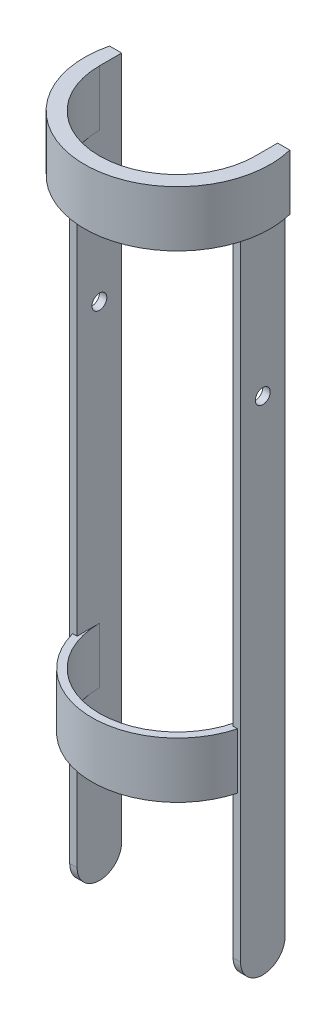
from build123d import *

# Parameters (mm, degrees)
EXTRUDE_1_DEPTH     = 30
SKETCH_2_W          = 4
SKETCH_2_H          = 24
EXTRUDE_2_DEPTH     = 120
CUT_EXTRUDE_1_DEPTH = 137.674796506
SKETCH_4_W          = 4
SKETCH_4_H          = 24
EXTRUDE_3_DEPTH     = 260
EXTRUDE_START       = -30
EXTRUDE_4_DEPTH     = 30
SKETCH_6_R          = 4
CUT_EXTRUDE_2_DEPTH = 310.541596559


with BuildPart() as part:
    # 草图1 → 凸台-拉伸1 (new body)
    with BuildSketch(Plane(origin=(0, 0, 0), x_dir=(1, 0, 0), z_dir=(0, 1, 0))):
        with BuildLine():
            Line((-46, 0), (-46, 12))
            Line((-46, 12), (-42, 12))
            Line((-42, 12), (-42, 0))
            ThreePointArc((-42, 0), (0, -42), (42, 0))
            Line((42, 0), (42, 12))
            Line((42, 12), (46, 12))
            Line((46, 12), (46, 0))
            ThreePointArc((46, 0), (0, -46), (-46, 0))
        make_face()
    extrude(amount=EXTRUDE_1_DEPTH)

    # 草图2 → 凸台-拉伸2 (add)
    with BuildSketch(Plane(origin=(0, 30, 0), x_dir=(1, 0, 0), z_dir=(0, 1, 0))):
        with Locations((-44, 0)):
            Rectangle(SKETCH_2_W, SKETCH_2_H)
        with Locations((44, 0)):
            Rectangle(SKETCH_2_W, SKETCH_2_H)
    extrude(amount=-EXTRUDE_2_DEPTH)

    # 草图3 → 切除-拉伸1 (cut, through all)
    with BuildSketch(Plane(origin=(46, 0, 0), x_dir=(0, 0, -1), z_dir=(1, 0, 0))):
        with BuildLine():
            Line((-12, -78), (-12, -98.506149354))
            Line((-12, -98.506149354), (12, -98.506149354))
            Line((12, -98.506149354), (12, -78))
            ThreePointArc((12, -78), (0, -90), (-12, -78))
        make_face()
    extrude(amount=-CUT_EXTRUDE_1_DEPTH, mode=Mode.SUBTRACT)

    # 草图4 → 凸台-拉伸3 (add)
    with BuildSketch(Plane(origin=(0, 30, 0), x_dir=(1, 0, 0), z_dir=(0, 1, 0))):
        with Locations((44, 0)):
            Rectangle(SKETCH_4_W, SKETCH_4_H)
        with Locations((-44, 0)):
            Rectangle(SKETCH_4_W, SKETCH_4_H)
    extrude(amount=EXTRUDE_3_DEPTH)

    # 草图5 → 凸台-拉伸4 (add)
    with BuildSketch(Plane(origin=(0, 290, 0), x_dir=(1, 0, 0), z_dir=(0, 1, 0)).offset(EXTRUDE_START)):
        with BuildLine():
            Line((-48.538644398, 12), (-42, 12))
            Line((-42, 12), (-42, 0))
            ThreePointArc((-42, 0), (0, -42), (42, 0))
            Line((42, 0), (42, 12))
            Line((42, 12), (48.538644398, 12))
            ThreePointArc((48.538644398, 12), (0, -50), (-48.538644398, 12))
        make_face()
    extrude(amount=EXTRUDE_4_DEPTH)

    # 草图6 → 切除-拉伸2 (cut, through all)
    with BuildSketch(Plane(origin=(46, 0, 0), x_dir=(0, 0, -1), z_dir=(1, 0, 0))):
        with Locations((0, 180)):
            Circle(SKETCH_6_R)
    extrude(amount=-CUT_EXTRUDE_2_DEPTH, mode=Mode.SUBTRACT)


solid = part.part
